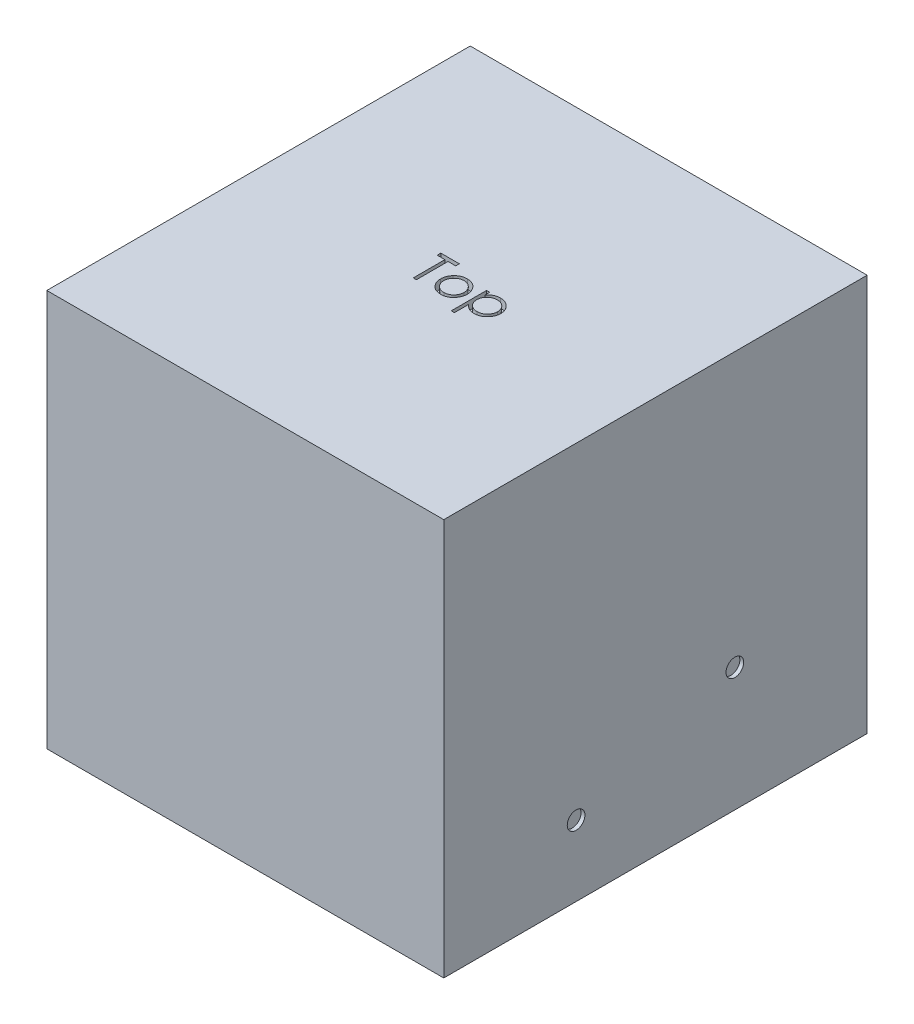
from build123d import *

# Parameters (mm, degrees)
SKETCH1_W               = 225
SKETCH1_H               = 240
BOSS_EXTRUDE1_DEPTH     = 225
CUT_EXTRUDE1_DEPTH      = 5
CUT_EXTRUDE1_DEPTH_BACK = 5
CUT_EXTRUDE2_START      = -2.2
SKETCH3_R               = 5.01
CUT_EXTRUDE2_DEPTH      = 9.2


with BuildPart() as part:
    # Sketch1 → Boss-Extrude1 (new body)
    with BuildSketch(Plane(origin=(0, 0, 0), x_dir=(1, 0, 0), z_dir=(0, 1, 0))):
        with Locations((-26.258071592, 96.687140421)):
            Rectangle(SKETCH1_W, SKETCH1_H)
    extrude(amount=BOSS_EXTRUDE1_DEPTH)

    # Sketch2 → Cut-Extrude1 (cut, two sides: drawn at the far end of the back side and taken through both)
    # profile 1 of 3: a face of its own
    with BuildSketch(Plane(origin=(0, 225, 0), x_dir=(1, 0, 0), z_dir=(0, 1, 0)).offset(-CUT_EXTRUDE1_DEPTH_BACK)):
        Polygon((-45.428715414, 104.63585837), (-45.428715414, 106.687140421), (-34.915894901, 106.687140421), (-34.915894901, 104.63585837), (-39.27486926, 104.63585837), (-39.27486926, 86.687140421), (-41.069741055, 86.687140421), (-41.069741055, 104.63585837), align=None)
    # profile 2 of 3: a face of its own
    with BuildSketch(Plane(origin=(0, 225, 0), x_dir=(1, 0, 0), z_dir=(0, 1, 0)).offset(-CUT_EXTRUDE1_DEPTH_BACK)):
        with BuildLine():
            add(Edge.make_bspline(
                [(-25.292497466, 101.558935293), (-25.018261621, 101.553095915), (-24.480552149, 101.541646322), (-23.693078515, 101.419275089), (-22.941392024, 101.232147293), (-22.222613783, 100.973452652), (-21.545949238, 100.626698649), (-20.901542129, 100.212931271), (-20.291159221, 99.722745022), (-19.925313339, 99.34355606), (-19.73961285, 99.151082729)],
                knots=[0, 0, 0, 0, 1.054011418, 2.066658804, 3.057071809, 4.030435133, 4.997543892, 5.974964718, 6.972108034, 8, 8, 8, 8], degree=3))
            add(Edge.make_bspline(
                [(-19.73961285, 99.151082729), (-19.57971597, 98.96700281), (-19.263016654, 98.602405426), (-18.856926833, 98.011230494), (-18.507089346, 97.399001348), (-18.226729569, 96.757588053), (-18.005672291, 96.092589932), (-17.848725455, 95.401721297), (-17.755371541, 94.686507884), (-17.742783158, 94.200771667), (-17.736407722, 93.954768626)],
                knots=[0, 0, 0, 0, 1.025258237, 2.030674902, 3.01204498, 3.988269485, 4.97094183, 5.956517959, 6.965070386, 8, 8, 8, 8], degree=3))
            add(Edge.make_bspline(
                [(-17.736407722, 93.954768626), (-17.742015364, 93.707339725), (-17.753096326, 93.218408677), (-17.857916991, 92.498298016), (-18.020951767, 91.800041886), (-18.254276557, 91.126563636), (-18.553465752, 90.475804622), (-18.918555396, 89.850607198), (-19.352107494, 89.249737865), (-19.843558904, 88.678298789), (-20.386712482, 88.151634705), (-20.975947615, 87.692616021), (-21.599684951, 87.299350168), (-22.266218398, 86.98257065), (-22.96946118, 86.732800934), (-23.71093014, 86.557372269), (-24.489473399, 86.451305504), (-25.021057521, 86.437685086), (-25.292497466, 86.430730164)],
                knots=[0, 0, 0, 0, 0.998656419, 1.973391657, 2.932242238, 3.890759089, 4.846373663, 5.82037756, 6.809684879, 7.83454468, 8.860553229, 9.859544525, 10.845671541, 11.83227036, 12.833544569, 13.85385346, 14.904124723, 16, 16, 16, 16], degree=3))
            add(Edge.make_bspline(
                [(-25.292497466, 86.430730164), (-25.565267291, 86.437708429), (-26.099500775, 86.451375711), (-26.880792101, 86.556960184), (-27.623589923, 86.732720084), (-28.327753343, 86.983391471), (-28.997152469, 87.299360293), (-29.62450388, 87.69142709), (-30.214217683, 88.151770835), (-30.757486165, 88.678261904), (-31.248906767, 89.249747368), (-31.682466815, 89.850604731), (-32.047554393, 90.475805265), (-32.346744129, 91.126563465), (-32.580068775, 91.800041932), (-32.74310359, 92.498298003), (-32.847924244, 93.218408681), (-32.859005208, 93.707339726), (-32.86461285, 93.954768626)],
                knots=[0, 0, 0, 0, 1.099876186, 2.154163076, 3.173186993, 4.173200201, 5.163417411, 6.152872554, 7.150605724, 8.17532212, 9.198891216, 10.186952605, 11.159729845, 12.11414092, 13.071450619, 14.029093627, 15.002601286, 16, 16, 16, 16], degree=3))
            add(Edge.make_bspline(
                [(-32.86461285, 93.954768626), (-32.858193934, 94.199434602), (-32.845485583, 94.683831188), (-32.752225531, 95.397700106), (-32.595890922, 96.087399472), (-32.374568657, 96.749830763), (-32.091624709, 97.388433255), (-31.746703064, 98.002175146), (-31.336470878, 98.590676863), (-31.021031155, 98.954803035), (-30.861407722, 99.139063498)],
                knots=[0, 0, 0, 0, 1.031353054, 2.041901799, 3.029428768, 4.008703097, 4.981709435, 5.96992636, 6.972712378, 8, 8, 8, 8], degree=3))
            add(Edge.make_bspline(
                [(-30.861407722, 99.139063498), (-30.675987202, 99.333206008), (-30.311325123, 99.715021415), (-29.697903821, 100.203778695), (-29.055081986, 100.62615626), (-28.370939551, 100.966020348), (-27.652751792, 101.233669021), (-26.897213263, 101.419757679), (-26.10706746, 101.541205422), (-25.566726768, 101.552966438), (-25.292497466, 101.558935293)],
                knots=[0, 0, 0, 0, 1.027980169, 2.021703884, 2.998553061, 3.971491411, 4.943284454, 5.930300938, 6.949603206, 8, 8, 8, 8], degree=3))
        make_face()
        with BuildLine():
            add(Edge.make_bspline(
                [(-25.300510286, 99.764063498), (-25.494439494, 99.758551545), (-25.877291657, 99.747669931), (-26.440832142, 99.664904761), (-26.983347307, 99.533776166), (-27.505866416, 99.347467273), (-28.006627401, 99.106902137), (-28.486109701, 98.811425793), (-28.945723643, 98.464951756), (-29.376478291, 98.068022204), (-29.771805789, 97.634427949), (-30.117394227, 97.172437327), (-30.411251977, 96.68954392), (-30.656052886, 96.18524557), (-30.838379675, 95.654431776), (-30.970796946, 95.103113884), (-31.053484034, 94.530168647), (-31.064263341, 94.140677114), (-31.069741055, 93.942749395)],
                knots=[0, 0, 0, 0, 1.021534396, 2.016698045, 2.994645724, 3.958388632, 4.93408049, 5.916473867, 6.921342795, 7.962252576, 8.998418191, 10.008913653, 10.997312074, 11.973003931, 12.956656626, 13.948281152, 14.957379055, 16, 16, 16, 16], degree=3))
            add(Edge.make_bspline(
                [(-31.069741055, 93.942749395), (-31.060559206, 93.687023526), (-31.042334952, 93.179455494), (-30.894133601, 92.431963365), (-30.646212002, 91.714352781), (-30.311427546, 91.030830575), (-29.891963439, 90.398417558), (-29.39775163, 89.834580505), (-28.834096199, 89.347804439), (-28.207716198, 88.943913893), (-27.53140581, 88.623001003), (-26.815655404, 88.395578285), (-26.069137152, 88.247740043), (-25.558961545, 88.233045904), (-25.300510286, 88.225601959)],
                knots=[0, 0, 0, 0, 1.016792936, 2.018143844, 3.017858371, 4.030088057, 5.03801393, 6.028138512, 7.003788237, 7.991172063, 8.984598303, 9.972568034, 10.972917682, 12, 12, 12, 12], degree=3))
            add(Edge.make_bspline(
                [(-25.300510286, 88.225601959), (-25.042073892, 88.233089275), (-24.531927629, 88.247869029), (-23.786446619, 88.394833713), (-23.072652494, 88.623997488), (-22.397044565, 88.943552973), (-21.770949689, 89.3493382), (-21.203240424, 89.831831784), (-20.71324836, 90.399910934), (-20.294199189, 91.031668242), (-19.953932088, 91.713293111), (-19.707170935, 92.43209581), (-19.558613301, 93.179421764), (-19.540437137, 93.687012225), (-19.531279517, 93.942749395)],
                knots=[0, 0, 0, 0, 1.02726834, 2.027799167, 3.010890988, 4.004497153, 4.992059811, 5.971914811, 6.958719428, 7.966827853, 8.981595046, 9.981490638, 10.983022906, 12, 12, 12, 12], degree=3))
            add(Edge.make_bspline(
                [(-19.531279517, 93.942749395), (-19.536755346, 94.140678296), (-19.547530941, 94.530172157), (-19.630245023, 95.103100464), (-19.762562392, 95.654481016), (-19.945257348, 96.185063892), (-20.18899457, 96.690849631), (-20.488519102, 97.1710195), (-20.83269639, 97.636028334), (-21.232794224, 98.066620567), (-21.66309924, 98.46510649), (-22.122899458, 98.811560144), (-22.601670764, 99.105603547), (-23.100976951, 99.349524922), (-23.623563052, 99.532081152), (-24.165318076, 99.665661904), (-24.726454133, 99.74732017), (-25.107934379, 99.758446693), (-25.300510286, 99.764063498)],
                knots=[0, 0, 0, 0, 1.042956736, 2.052379634, 3.044323526, 4.02829302, 5.004299113, 5.996692471, 7.007513377, 8.048758398, 9.090003419, 10.095195979, 11.07790575, 12.047570684, 13.018257071, 13.989683339, 14.985167495, 16, 16, 16, 16], degree=3))
        make_face(mode=Mode.SUBTRACT)
    # profile 3 of 3: a face of its own
    with BuildSketch(Plane(origin=(0, 225, 0), x_dir=(1, 0, 0), z_dir=(0, 1, 0)).offset(-CUT_EXTRUDE1_DEPTH_BACK)):
        with BuildLine():
            Line((-14.146664132, 101.302525036), (-12.351792337, 101.302525036))
            Line((-12.351792337, 101.302525036), (-12.351792337, 98.598198113))
            add(Edge.make_bspline(
                [(-12.351792337, 98.598198113), (-12.161178143, 98.843556592), (-11.790757602, 99.320361694), (-11.152329574, 99.937448143), (-10.478462094, 100.45787845), (-9.751814023, 100.865778639), (-8.983678651, 101.173326135), (-8.177208266, 101.400637277), (-7.325558181, 101.534588561), (-6.743292737, 101.550712339), (-6.446343619, 101.558935293)],
                knots=[0, 0, 0, 0, 1.0828784, 2.104357462, 3.088488658, 4.04616522, 5.001424249, 5.969181776, 6.964304535, 8, 8, 8, 8], degree=3))
            add(Edge.make_bspline(
                [(-6.446343619, 101.558935293), (-6.18696303, 101.551431413), (-5.674283668, 101.536599601), (-4.919636646, 101.436182147), (-4.192920168, 101.264081047), (-3.498245574, 101.016075816), (-2.828170916, 100.709473131), (-2.19261606, 100.322518642), (-1.581681456, 99.874483266), (-1.010731804, 99.358870976), (-0.483181133, 98.800995168), (-0.02691724, 98.200867715), (0.366636498, 97.578224365), (0.684752478, 96.923412409), (0.933943035, 96.241588239), (1.111169764, 95.529997148), (1.216642013, 94.791277488), (1.230793165, 94.288976228), (1.237951252, 94.034896831)],
                knots=[0, 0, 0, 0, 1.041296284, 2.058176809, 3.050446431, 4.034000596, 5.01514041, 6.003636468, 7.015969324, 8.052561599, 9.08815499, 10.094063707, 11.074456064, 12.040834395, 13.011057502, 13.983766392, 14.980127149, 16, 16, 16, 16], degree=3))
            add(Edge.make_bspline(
                [(1.237951252, 94.034896831), (1.230948478, 93.775455068), (1.217137996, 93.263798471), (1.110023676, 92.51244363), (0.938841538, 91.789658636), (0.692794777, 91.096645701), (0.374843415, 90.43388198), (-0.012039787, 89.801845431), (-0.468533885, 89.200738556), (-0.990254614, 88.638721984), (-1.556271392, 88.121011624), (-2.161285617, 87.668222655), (-2.795908049, 87.287986225), (-3.456891861, 86.970369313), (-4.14989551, 86.730985404), (-4.871685668, 86.558312258), (-5.621869363, 86.451829425), (-6.13216166, 86.437817182), (-6.390253876, 86.430730164)],
                knots=[0, 0, 0, 0, 1.038740735, 2.04854663, 3.033179607, 4.009277356, 4.987731542, 5.972001279, 6.972200261, 8.005528982, 9.039189865, 10.040446548, 11.026516639, 11.997840187, 12.972163198, 13.956796175, 14.96660207, 16, 16, 16, 16], degree=3))
            add(Edge.make_bspline(
                [(-6.390253876, 86.430730164), (-6.680697144, 86.438129066), (-7.25440775, 86.452744065), (-8.093251581, 86.600854979), (-8.900547878, 86.822208897), (-9.66735259, 87.146203147), (-10.399740091, 87.559091809), (-11.093567552, 88.0625787), (-11.752520426, 88.655610841), (-12.149141896, 89.105506934), (-12.351792337, 89.3353776)],
                knots=[0, 0, 0, 0, 1.014726462, 2.004382257, 2.969841629, 3.936926163, 4.907207904, 5.903978561, 6.929055279, 8, 8, 8, 8], degree=3))
            Line((-12.351792337, 89.3353776), (-12.351792337, 81.302525036))
            Line((-12.351792337, 81.302525036), (-14.146664132, 81.302525036))
            Line((-14.146664132, 81.302525036), (-14.146664132, 101.302525036))
        make_face()
        with BuildLine():
            add(Edge.make_bspline(
                [(-6.46236926, 99.764063498), (-6.665681046, 99.760404879), (-7.065949548, 99.753202003), (-7.652647942, 99.667636581), (-8.217764672, 99.543420917), (-8.755604394, 99.355352916), (-9.271322203, 99.124502555), (-9.760946001, 98.836033919), (-10.224132102, 98.495165315), (-10.659715132, 98.108426207), (-11.053219667, 97.682285132), (-11.401579255, 97.227497651), (-11.694192427, 96.74463971), (-11.937061114, 96.238209067), (-12.121879872, 95.704236009), (-12.253055414, 95.145761651), (-12.335514573, 94.562174723), (-12.3463085, 94.164711829), (-12.351792337, 93.962781446)],
                knots=[0, 0, 0, 0, 1.05670511, 2.080379991, 3.077984906, 4.06214886, 5.038337365, 6.01289324, 7.01187578, 8.025460281, 9.038092164, 10.024533457, 11.000252242, 11.969694649, 12.940728589, 13.933144304, 14.949937299, 16, 16, 16, 16], degree=3))
            add(Edge.make_bspline(
                [(-12.351792337, 93.962781446), (-12.342701731, 93.697706518), (-12.324892463, 93.178402282), (-12.180107504, 92.419635871), (-11.944477423, 91.701626411), (-11.610027631, 91.030420486), (-11.187470064, 90.413375713), (-10.678337741, 89.860857962), (-10.08723745, 89.376340299), (-9.423996354, 88.968218849), (-8.713012751, 88.63685847), (-7.971378968, 88.39963441), (-7.209293934, 88.253507391), (-6.694046393, 88.234954139), (-6.434324389, 88.225601959)],
                knots=[0, 0, 0, 0, 1.03728447, 2.032128127, 3.01272805, 3.987917167, 4.958271349, 5.931593992, 6.91984656, 7.941419022, 8.973179163, 9.983609215, 10.983593296, 12, 12, 12, 12], degree=3))
            add(Edge.make_bspline(
                [(-6.434324389, 88.225601959), (-6.179834286, 88.234495541), (-5.674717183, 88.252147703), (-4.930956489, 88.404937347), (-4.208152841, 88.638337487), (-3.521408998, 88.97867781), (-2.876703354, 89.395763855), (-2.294523048, 89.896106902), (-1.785912113, 90.476049435), (-1.352401513, 91.121812308), (-1.00307874, 91.814243072), (-0.740620226, 92.53070815), (-0.589142665, 93.268681996), (-0.567675302, 93.765811784), (-0.556920543, 94.01486478)],
                knots=[0, 0, 0, 0, 1.00104056, 1.986885549, 2.97790532, 3.984399681, 4.995088187, 5.994304198, 6.996462723, 8.023150851, 9.048424203, 10.043036403, 11.019596776, 12, 12, 12, 12], degree=3))
            add(Edge.make_bspline(
                [(-0.556920543, 94.01486478), (-0.565233307, 94.265464718), (-0.581794072, 94.764712167), (-0.744920002, 95.500500184), (-0.990062731, 96.219860048), (-1.347543028, 96.902834618), (-1.771550282, 97.547257947), (-2.284390265, 98.116137255), (-2.859339959, 98.614255385), (-3.503278039, 99.025772013), (-4.194366184, 99.353117699), (-4.921879989, 99.592452778), (-5.682129146, 99.736302775), (-6.200001458, 99.754728525), (-6.46236926, 99.764063498)],
                knots=[0, 0, 0, 0, 0.983928682, 1.960191568, 2.949917689, 3.96440592, 4.982380491, 5.975291189, 6.965713506, 7.964880129, 8.970154049, 9.96478489, 10.968906225, 12, 12, 12, 12], degree=3))
        make_face(mode=Mode.SUBTRACT)
    extrude(amount=CUT_EXTRUDE1_DEPTH + CUT_EXTRUDE1_DEPTH_BACK, mode=Mode.SUBTRACT)

    # Sketch3 → Cut-Extrude2 (cut)
    with BuildSketch(Plane(origin=(86.241928408, 0, 0), x_dir=(0, 0, -1), z_dir=(1, 0, 0)).offset(CUT_EXTRUDE2_START)):
        with Locations((141.687140421, 70)):
            Circle(SKETCH3_R)
        with Locations((51.687140421, 40)):
            Circle(SKETCH3_R)
    cut_extrude2 = extrude(amount=CUT_EXTRUDE2_DEPTH, mode=Mode.SUBTRACT)

    # Mirror2: Cut-Extrude2 across plane
    add(cut_extrude2.mirror(Plane.ZY.offset(26.258071592)), mode=Mode.SUBTRACT)


solid = part.part
